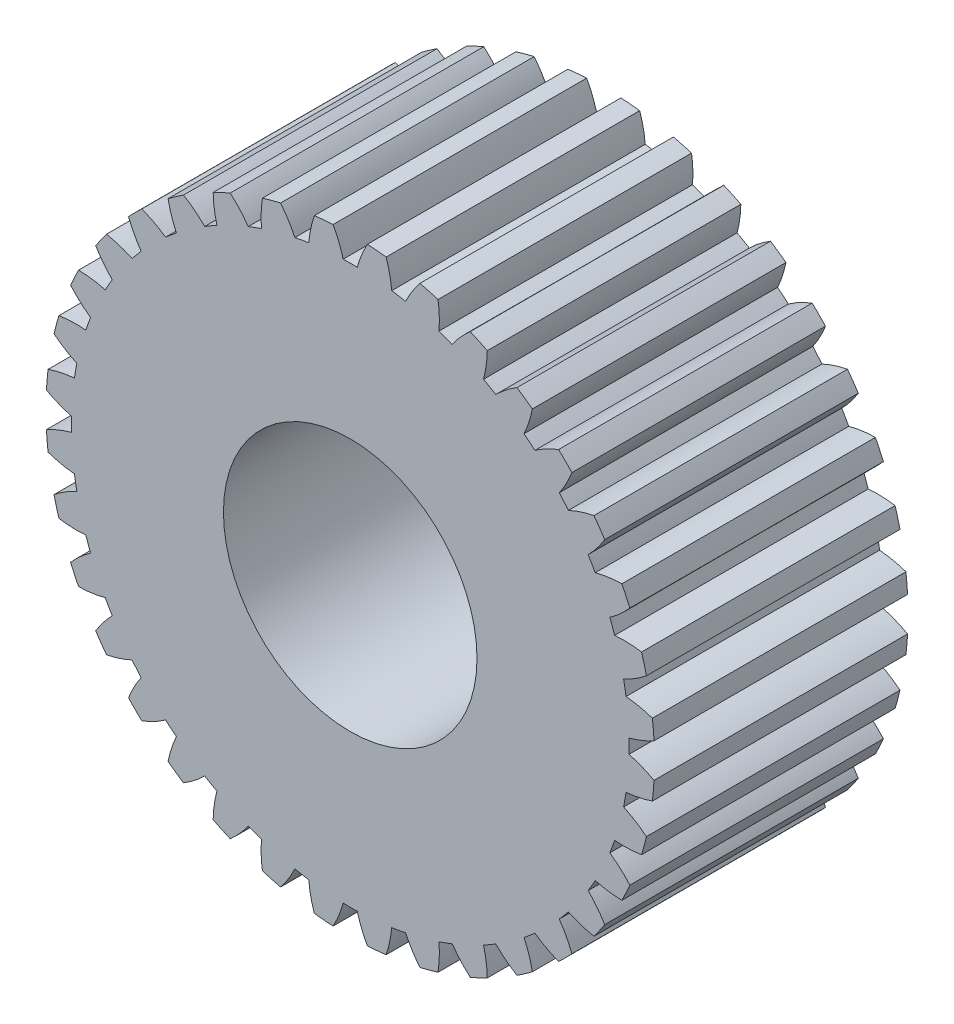
from build123d import *

# Parameters (mm, degrees)
SKETCH1_R           = 12
SKETCH1_R_2         = 5
BOSS_EXTRUDE1_DEPTH = 5
CUT_EXTRUDE1_DEPTH  = 5
CIRPATTERN1_COUNT   = 36


with BuildPart() as part:
    # Sketch1 → Boss-Extrude1 (new, symmetric)
    with BuildSketch(Plane.XY):
        Circle(SKETCH1_R)
        Circle(SKETCH1_R_2, mode=Mode.SUBTRACT)
    extrude(amount=BOSS_EXTRUDE1_DEPTH, both=True)

    # Sketch2 → Cut-Extrude1 (cut, symmetric)
    with BuildSketch(Plane.XY):
        with BuildLine():
            ThreePointArc((0.277701395, 10.996494075), (0, 11), (-0.277701395, 10.996494075))
            add(Edge.make_bspline(
                [(-0.277701395, 10.996494075), (-0.416915395, 11.513062506), (-0.675419273, 11.980976955)],
                knots=[0, 0, 0, 1, 1, 1], degree=2))
            ThreePointArc((-0.675419273, 11.980976955), (0, 12), (0.675419273, 11.980976955))
            add(Edge.make_bspline(
                [(0.277701395, 10.996494075), (0.416915395, 11.513062506), (0.675419273, 11.980976955)],
                knots=[0, 0, 0, 1, 1, 1], degree=2))
        make_face()
    cut_extrude1 = extrude(amount=CUT_EXTRUDE1_DEPTH, both=True, mode=Mode.SUBTRACT)

    # CirPattern1: Cut-Extrude1 ×36 about axis
    cirpattern1_axis = Axis((0, 0, 5), (0, 0, -1))
    for i in range(1, CIRPATTERN1_COUNT):
        add(cut_extrude1.rotate(cirpattern1_axis, i * 360 / CIRPATTERN1_COUNT), mode=Mode.SUBTRACT)


solid = part.part
